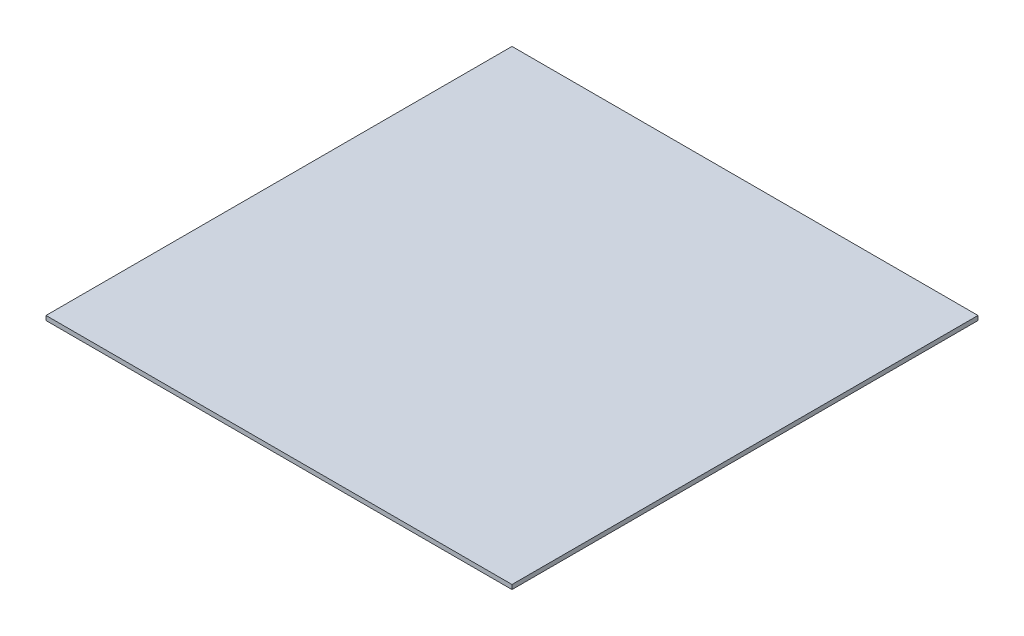
from build123d import *

# Parameters (mm, degrees)
SKETCH1_W           = 400
SKETCH1_H           = 400
BOSS_EXTRUDE1_DEPTH = 3.8


with BuildPart() as part:
    # Sketch1 → Boss-Extrude1 (new body)
    with BuildSketch(Plane(origin=(0, 0, 0), x_dir=(1, 0, 0), z_dir=(0, 1, 0))):
        Rectangle(SKETCH1_W, SKETCH1_H)
    extrude(amount=BOSS_EXTRUDE1_DEPTH)


solid = part.part
